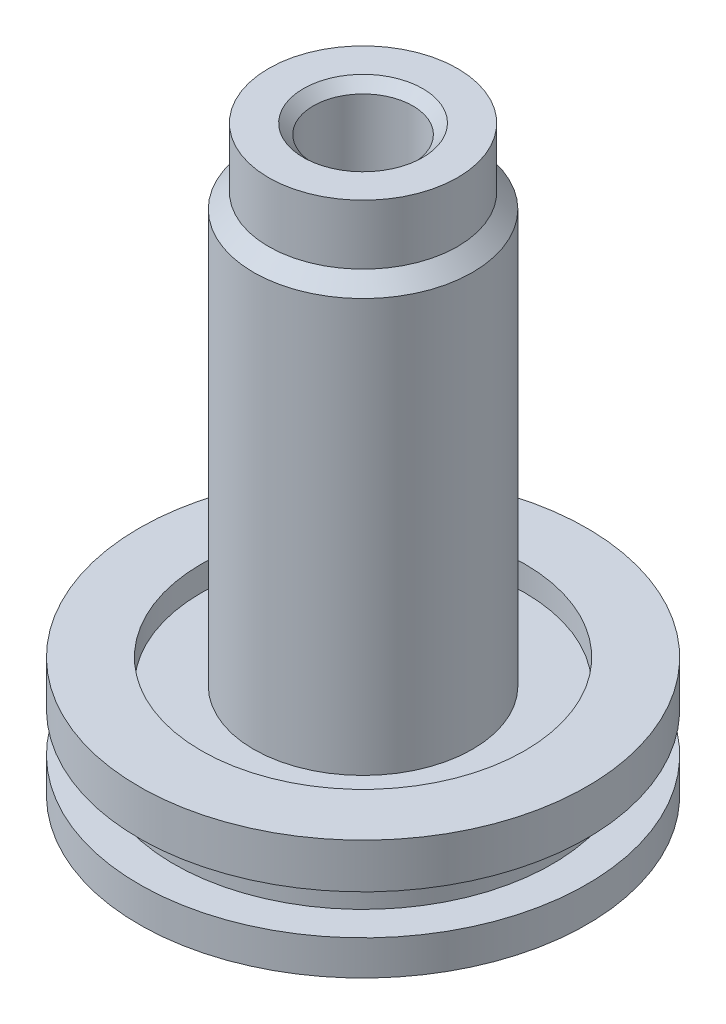
from build123d import *


with BuildPart() as part:
    # Эскиз1 → Повернуть1 (revolve)
    with BuildSketch(Plane(origin=(0, 0, 0), x_dir=(-1, 0, 0), z_dir=(0, 0, -1)), mode=Mode.PRIVATE) as revolve_1_sk:
        Polygon((-22, 0), (0, 0), (0, 20.07179677), (-12, 27), (-12, 59), (-10, 59), (-10, 123), (-12, 125), (-19, 125), (-19, 113), (-22, 110), (-22, 27), (-32.5, 27), (-32.5, 32), (-45, 32), (-45, 23), (-38, 23), (-38, 15), (-45, 15), (-45, 8), (-22, 8), align=None)
    revolve(revolve_1_sk.sketch.rotate(Axis((0, 0, 0), (0, 1, 0)), 180), axis=Axis((0, 0, 0), (0, 1, 0)))


solid = part.part
